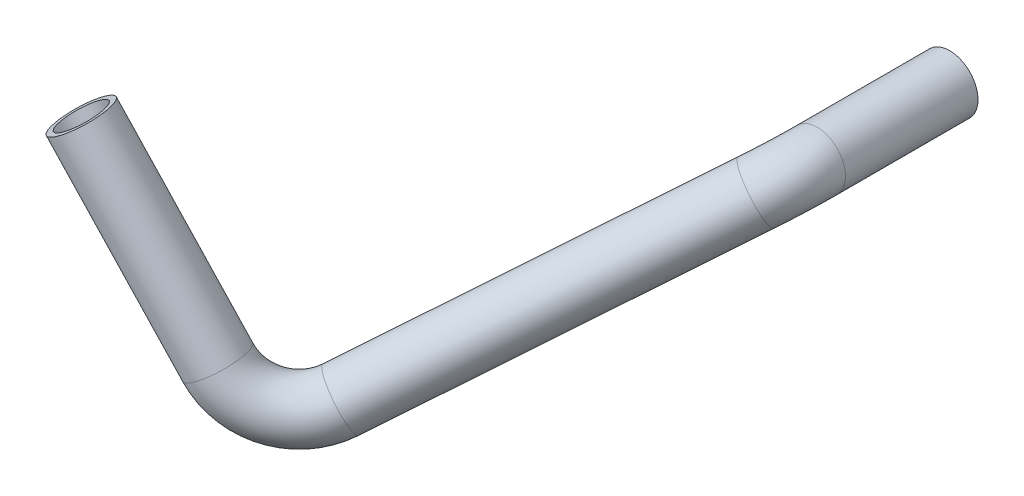
from build123d import *

# Parameters (mm, degrees)
PIPESKETCH_R    = 16.764
PIPESKETCH_R_2  = 13.3858
EXTRUSION_DEPTH = 78.43305879
SKETCH_1_R      = 16.764
SKETCH_1_R_2    = 13.3858
REVOLVE_1_ANGLE = 45.819311821
SKETCH_2_R      = 16.764
SKETCH_2_R_2    = 13.3858
EXTRUDE_1_DEPTH = 197.43866419
SKETCH_3_R      = 16.764
SKETCH_3_R_2    = 13.3858
REVOLVE_2_ANGLE = 90
SKETCH_4_R      = 16.764
SKETCH_4_R_2    = 13.3858
EXTRUDE_2_DEPTH = 120.923725302


with BuildPart() as part:
    # PipeSketch → Extrusion (new body)
    with BuildSketch(Plane.XY):
        Circle(PIPESKETCH_R)
        Circle(PIPESKETCH_R_2, mode=Mode.SUBTRACT)
    extrude(amount=EXTRUSION_DEPTH)

    # 草图1 → 旋转1 (revolve)
    with BuildSketch(Plane.XY.offset(78.43305879)):
        with Locations(Location((0, 0, 0), (0, 0, 40.203758457))):
            Circle(SKETCH_1_R)
        with Locations(Location((0, 0, 0), (0, 0, 40.203758457))):
            Circle(SKETCH_1_R_2, mode=Mode.SUBTRACT)
    revolve(axis=Axis((-29.09901546, -24.593846776, 78.43305879), (0.6455077894006402, -0.7637536866183356, 0)), revolution_arc=REVOLVE_1_ANGLE)

    # 草图2 → 凸台-拉伸1 (add)
    with BuildSketch(Plane(origin=(-44.905078471, -37.952783004, 57.137323745), x_dir=(0.8366600265340762, -0.3030542664308184, 0.4562434784170373), z_dir=(-0.5477225575051652, -0.4629230385328477, 0.6969234250586765))):
        with Locations(Location((43.130838557, 52.305939514, 0), (0, 0, 50.491424948))):
            Circle(SKETCH_2_R)
        with Locations(Location((43.130838557, 52.305939514, 0), (0, 0, 50.491424948))):
            Circle(SKETCH_2_R_2, mode=Mode.SUBTRACT)
    extrude(amount=EXTRUDE_1_DEPTH)

    # 草图3 → 旋转2 (revolve)
    with BuildSketch(Plane(origin=(-153.046688572, -129.351689355, 194.736953831), x_dir=(0.8366600265340762, -0.3030542664308184, 0.4562434784170373), z_dir=(-0.5477225575051652, -0.4629230385328477, 0.6969234250586765))):
        with Locations(Location((43.130838557, 52.305939514, 0), (0, 0, 310.893394649))):
            Circle(SKETCH_3_R)
        with Locations(Location((43.130838557, 52.305939514, 0), (0, 0, 310.893394649))):
            Circle(SKETCH_3_R_2, mode=Mode.SUBTRACT)
    revolve(axis=Axis((-137.829069481, -67.303204468, 247.911671562), (-0.6324555320336762, -0.31622776601683844, -0.707106781186547)), revolution_arc=REVOLVE_2_ANGLE)

    # 草图4 → 凸台-拉伸2 (add)
    with BuildSketch(Plane(origin=(-27.059582229, 40.909884227, 5.907369706), x_dir=(0.8366600265340752, 0.5420999882976981, 0.07827900540781119), z_dir=(-0.5477225575051666, 0.8280714102029578, 0.11957315586905065))):
        with Locations(Location((-157.337165059, -283.786451217, 0), (0, 0, 229.106605351))):
            Circle(SKETCH_4_R)
        with Locations(Location((-157.337165059, -283.786451217, 0), (0, 0, 229.106605351))):
            Circle(SKETCH_4_R_2, mode=Mode.SUBTRACT)
    extrude(amount=EXTRUDE_2_DEPTH)


solid = part.part
